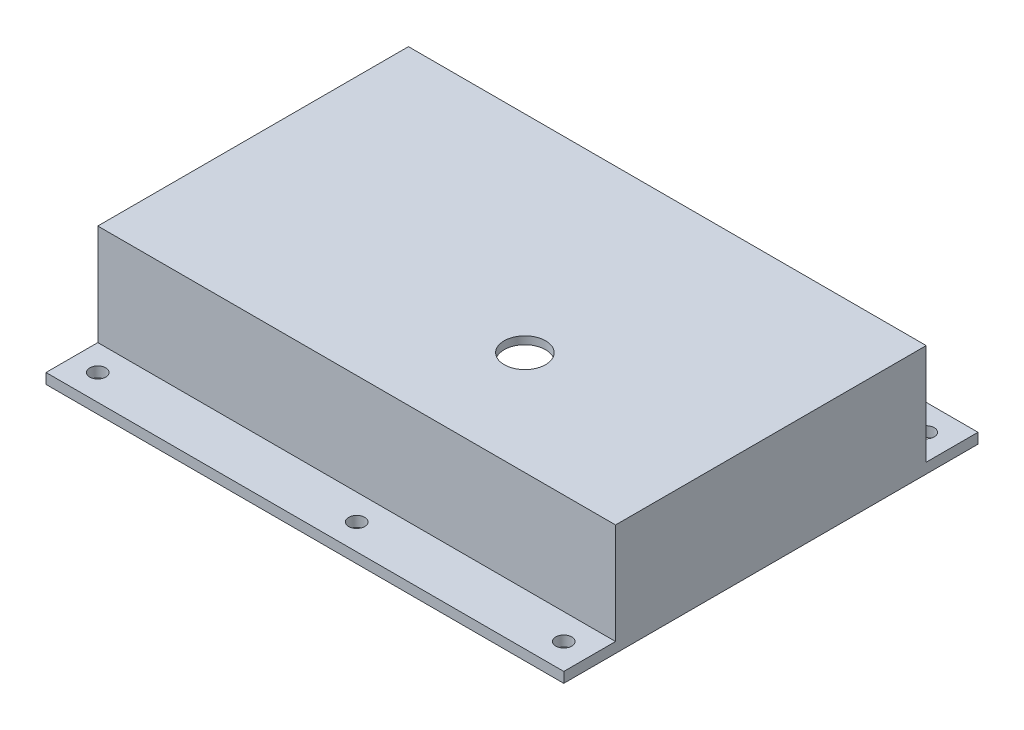
from build123d import *

# Parameters (mm, degrees)
SKETCH1_W           = 100
SKETCH1_H           = 60
SKETCH1_W_2         = 97
SKETCH1_H_2         = 57
BOSS_EXTRUDE1_DEPTH = 20
SKETCH2_W           = 100
SKETCH2_H           = 60
BOSS_EXTRUDE2_DEPTH = 1.5
SKETCH3_W           = 10
SKETCH3_H           = 2
BOSS_EXTRUDE3_DEPTH = 100
SKETCH4_R           = 1.55
CUT_EXTRUDE1_DEPTH  = 2
SKETCH5_R           = 4
CUT_EXTRUDE2_DEPTH  = 3


with BuildPart() as part:
    # Sketch1 → Boss-Extrude1 (new body)
    with BuildSketch(Plane(origin=(0, 0, 0), x_dir=(1, 0, 0), z_dir=(0, 1, 0))):
        Rectangle(SKETCH1_W, SKETCH1_H)
        Rectangle(SKETCH1_W_2, SKETCH1_H_2, mode=Mode.SUBTRACT)
    extrude(amount=BOSS_EXTRUDE1_DEPTH)

    # Sketch2 → Boss-Extrude2 (add)
    with BuildSketch(Plane(origin=(0, 20, 0), x_dir=(1, 0, 0), z_dir=(0, 1, 0))):
        Rectangle(SKETCH2_W, SKETCH2_H)
    extrude(amount=BOSS_EXTRUDE2_DEPTH)

    # Sketch3 → Boss-Extrude3 (add)
    with BuildSketch(Plane(origin=(50, 0, 0), x_dir=(0, 0, -1), z_dir=(1, 0, 0))):
        with Locations((-35, 1)):
            Rectangle(SKETCH3_W, SKETCH3_H)
        with Locations((35, 1)):
            Rectangle(SKETCH3_W, SKETCH3_H)
    extrude(amount=-BOSS_EXTRUDE3_DEPTH)

    # Sketch4 → Cut-Extrude1 (cut)
    with BuildSketch(Plane.XZ):
        with Locations(Location((-45, 35, 0), (0, 0, 270))):
            Circle(SKETCH4_R)
        with Locations(Location((45, 35, 0), (0, 0, 270))):
            Circle(SKETCH4_R)
        with Locations(Location((45, -35, 0), (0, 0, 270))):
            Circle(SKETCH4_R)
        with Locations(Location((-45, -35, 0), (0, 0, 270))):
            Circle(SKETCH4_R)
        with Locations(Location((5, 35, 0), (0, 0, 270))):
            Circle(SKETCH4_R)
        with Locations(Location((5, -35, 0), (0, 0, 270))):
            Circle(SKETCH4_R)
    extrude(amount=-CUT_EXTRUDE1_DEPTH, mode=Mode.SUBTRACT)

    # Sketch5 → Cut-Extrude2 (cut)
    with BuildSketch(Plane(origin=(0, 21.5, 0), x_dir=(1, 0, 0), z_dir=(0, 1, 0))):
        with Locations(Location((12.44, -9.95, 0), (0, 0, 270))):
            Circle(SKETCH5_R)
    extrude(amount=-CUT_EXTRUDE2_DEPTH, mode=Mode.SUBTRACT)


solid = part.part
